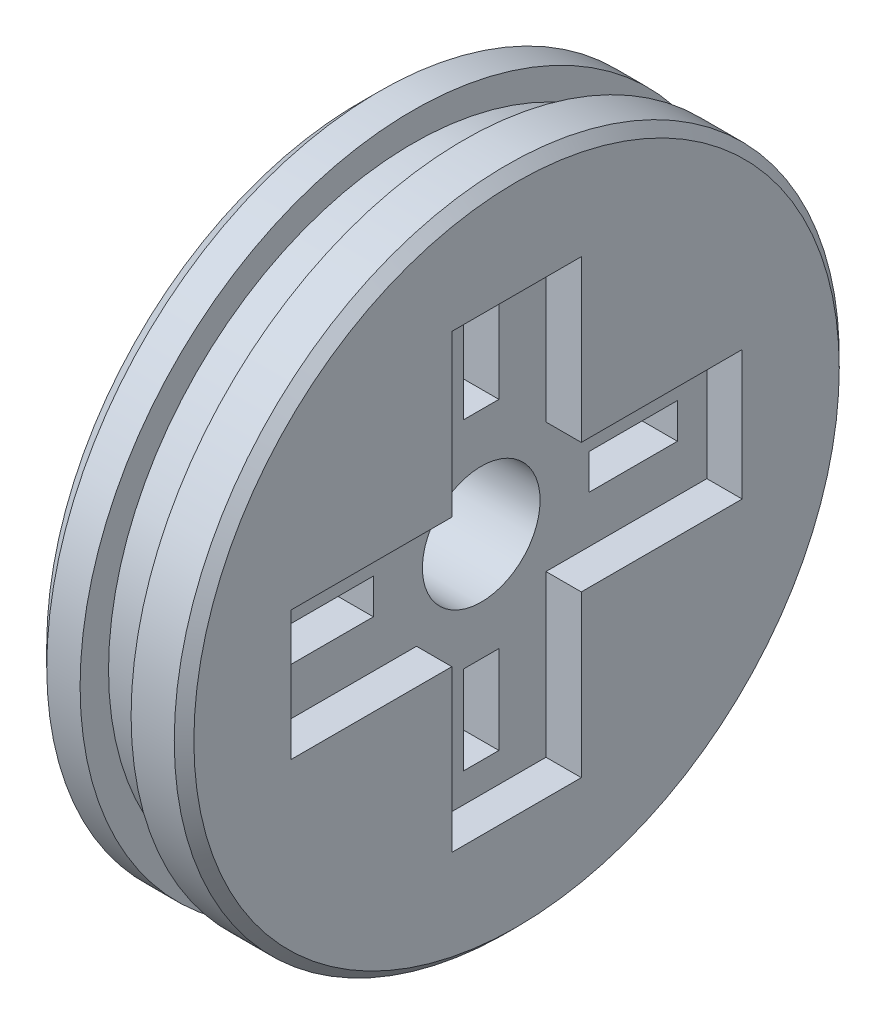
from build123d import *

# Parameters (mm, degrees)
SKETCH2_W            = 2.6
SKETCH2_H            = 2.45
BOSS_EXTRUDE1_START  = 62.7
SKETCH3_W            = 2.3
SKETCH3_H            = 23
BOSS_EXTRUDE1_DEPTH  = 6.6
BOSS_EXTRUDE2_START  = 54.5
SKETCH4_W            = 2.3
SKETCH4_H            = 6.6
BOSS_EXTRUDE2_DEPTH  = 23
BOSS_EXTRUDE3_START  = -79
SKETCH5_R            = 4.6
BOSS_EXTRUDE3_DEPTH  = 2.3
BOSS_EXTRUDE4_START  = -85.7
SKETCH6_R            = 7.1
BOSS_EXTRUDE4_DEPTH  = 1.7
BOSS_EXTRUDE5_START  = -84.1
SKETCH7_R            = 3
BOSS_EXTRUDE5_DEPTH  = 5.2
BOSS_EXTRUDE6_START  = 65.1
SKETCH8_W            = 4.1
SKETCH8_H            = 2.1
BOSS_EXTRUDE6_DEPTH  = 1.8
BOSS_EXTRUDE7_START  = 71.5
SKETCH9_W            = 4.1
SKETCH9_H            = 1.8
BOSS_EXTRUDE7_DEPTH  = 2.1
BOSS_EXTRUDE8_START  = 65.1
SKETCH10_W           = 4.1
SKETCH10_H           = 2.1
BOSS_EXTRUDE8_DEPTH  = 1.8
BOSS_EXTRUDE9_START  = 58.4
SKETCH11_W           = 4.1
SKETCH11_H           = 1.8
BOSS_EXTRUDE9_DEPTH  = 2.1
BOSS_EXTRUDE10_START = 65.1
SKETCH12_W           = 5.3
SKETCH12_H           = 2.4
BOSS_EXTRUDE10_DEPTH = 1.8
BOSS_EXTRUDE11_START = 73.6
SKETCH13_W           = 5.3
SKETCH13_H           = 1.8
BOSS_EXTRUDE11_DEPTH = 2.4
BOSS_EXTRUDE12_START = 65.1
SKETCH14_W           = 5.3
SKETCH14_H           = 2.4
BOSS_EXTRUDE12_DEPTH = 1.8
BOSS_EXTRUDE13_START = 56
SKETCH15_W           = 5.3
SKETCH15_H           = 1.8
BOSS_EXTRUDE13_DEPTH = 2.4


with BuildPart() as part:
    # Sketch1 → Revolve1 (revolve)
    with BuildSketch(Plane.XY.offset(66)):
        Polygon((-77.2, -65), (-85.2, -65), (-85.2, -49.05), (-84.2, -48.05), (-77.7, -48.05), (-77.2, -48.55), align=None)
    revolve(axis=Axis((-90.2, -65, 66), (1, 0, 0)))


with BuildPart() as body_2:
    # Sketch2 → Revolve2 (revolve)
    with BuildSketch(Plane.XY.offset(66)):
        with Locations((-81.2, -48.275)):
            Rectangle(SKETCH2_W, SKETCH2_H)
    revolve(axis=Axis((-87.5, -65, 66), (1, 0, 0)))


with BuildPart() as part_1:
    add(part.part)

    # Combine1: cut body 2
    add(body_2.part, mode=Mode.SUBTRACT)


with BuildPart() as body_2_2:
    # Sketch3 → Boss-Extrude1 (new body)
    with BuildSketch(Plane.XY.offset(BOSS_EXTRUDE1_START)):
        with Locations((-77.85, -65)):
            Rectangle(SKETCH3_W, SKETCH3_H)
    extrude(amount=BOSS_EXTRUDE1_DEPTH)


with BuildPart() as part_2:
    add(part_1.part)

    # Combine2: cut body 2 2
    add(body_2_2.part, mode=Mode.SUBTRACT)


with BuildPart() as body_2_3:
    # Sketch4 → Boss-Extrude2 (new body)
    with BuildSketch(Plane.XY.offset(BOSS_EXTRUDE2_START)):
        with Locations((-77.85, -65)):
            Rectangle(SKETCH4_W, SKETCH4_H)
    extrude(amount=BOSS_EXTRUDE2_DEPTH)


with BuildPart() as part_3:
    add(part_2.part)

    # Combine3: cut body 2 3
    add(body_2_3.part, mode=Mode.SUBTRACT)


with BuildPart() as body_2_4:
    # Sketch5 → Boss-Extrude3 (new body)
    with BuildSketch(Plane(origin=(0, 0, 0), x_dir=(0, 0, -1), z_dir=(1, 0, 0)).offset(BOSS_EXTRUDE3_START)):
        with Locations((-66, -65)):
            Circle(SKETCH5_R)
    extrude(amount=BOSS_EXTRUDE3_DEPTH)


with BuildPart() as part_4:
    add(part_3.part)

    # Combine4: cut body 2 4
    add(body_2_4.part, mode=Mode.SUBTRACT)


with BuildPart() as body_2_5:
    # Sketch6 → Boss-Extrude4 (new body)
    with BuildSketch(Plane(origin=(0, 0, 0), x_dir=(0, 0, -1), z_dir=(1, 0, 0)).offset(BOSS_EXTRUDE4_START)):
        with Locations((-66, -65)):
            Circle(SKETCH6_R)
    extrude(amount=BOSS_EXTRUDE4_DEPTH)


with BuildPart() as part_5:
    add(part_4.part)

    # Combine5: cut body 2 5
    add(body_2_5.part, mode=Mode.SUBTRACT)


with BuildPart() as body_2_6:
    # Sketch7 → Boss-Extrude5 (new body)
    with BuildSketch(Plane(origin=(0, 0, 0), x_dir=(0, 0, -1), z_dir=(1, 0, 0)).offset(BOSS_EXTRUDE5_START)):
        with Locations((-66, -65)):
            Circle(SKETCH7_R)
    extrude(amount=BOSS_EXTRUDE5_DEPTH)


with BuildPart() as part_6:
    add(part_5.part)

    # Combine6: cut body 2 6
    add(body_2_6.part, mode=Mode.SUBTRACT)


with BuildPart() as body_2_7:
    # Sketch8 → Boss-Extrude6 (new body)
    with BuildSketch(Plane.XY.offset(BOSS_EXTRUDE6_START)):
        with Locations((-80.95, -58.45)):
            Rectangle(SKETCH8_W, SKETCH8_H)
    extrude(amount=BOSS_EXTRUDE6_DEPTH)


with BuildPart() as part_7:
    add(part_6.part)

    # Combine7: cut body 2 7
    add(body_2_7.part, mode=Mode.SUBTRACT)


with BuildPart() as body_2_8:
    # Sketch9 → Boss-Extrude7 (new body)
    with BuildSketch(Plane.XY.offset(BOSS_EXTRUDE7_START)):
        with Locations((-80.95, -65)):
            Rectangle(SKETCH9_W, SKETCH9_H)
    extrude(amount=BOSS_EXTRUDE7_DEPTH)


with BuildPart() as part_8:
    add(part_7.part)

    # Combine8: cut body 2 8
    add(body_2_8.part, mode=Mode.SUBTRACT)


with BuildPart() as body_2_9:
    # Sketch10 → Boss-Extrude8 (new body)
    with BuildSketch(Plane.XY.offset(BOSS_EXTRUDE8_START)):
        with Locations((-80.95, -71.55)):
            Rectangle(SKETCH10_W, SKETCH10_H)
    extrude(amount=BOSS_EXTRUDE8_DEPTH)


with BuildPart() as part_9:
    add(part_8.part)

    # Combine9: cut body 2 9
    add(body_2_9.part, mode=Mode.SUBTRACT)


with BuildPart() as body_2_10:
    # Sketch11 → Boss-Extrude9 (new body)
    with BuildSketch(Plane.XY.offset(BOSS_EXTRUDE9_START)):
        with Locations((-80.95, -65)):
            Rectangle(SKETCH11_W, SKETCH11_H)
    extrude(amount=BOSS_EXTRUDE9_DEPTH)


with BuildPart() as part_10:
    add(part_9.part)

    # Combine10: cut body 2 10
    add(body_2_10.part, mode=Mode.SUBTRACT)


with BuildPart() as body_2_11:
    # Sketch12 → Boss-Extrude10 (new body)
    with BuildSketch(Plane.XY.offset(BOSS_EXTRUDE10_START)):
        with Locations((-81.55, -56.2)):
            Rectangle(SKETCH12_W, SKETCH12_H)
    extrude(amount=BOSS_EXTRUDE10_DEPTH)


with BuildPart() as part_11:
    add(part_10.part)

    # Combine11: cut body 2 11
    add(body_2_11.part, mode=Mode.SUBTRACT)


with BuildPart() as body_2_12:
    # Sketch13 → Boss-Extrude11 (new body)
    with BuildSketch(Plane.XY.offset(BOSS_EXTRUDE11_START)):
        with Locations((-81.55, -65)):
            Rectangle(SKETCH13_W, SKETCH13_H)
    extrude(amount=BOSS_EXTRUDE11_DEPTH)


with BuildPart() as part_12:
    add(part_11.part)

    # Combine12: cut body 2 12
    add(body_2_12.part, mode=Mode.SUBTRACT)


with BuildPart() as body_2_13:
    # Sketch14 → Boss-Extrude12 (new body)
    with BuildSketch(Plane.XY.offset(BOSS_EXTRUDE12_START)):
        with Locations((-81.55, -73.8)):
            Rectangle(SKETCH14_W, SKETCH14_H)
    extrude(amount=BOSS_EXTRUDE12_DEPTH)


with BuildPart() as part_13:
    add(part_12.part)

    # Combine13: cut body 2 13
    add(body_2_13.part, mode=Mode.SUBTRACT)


with BuildPart() as body_2_14:
    # Sketch15 → Boss-Extrude13 (new body)
    with BuildSketch(Plane.XY.offset(BOSS_EXTRUDE13_START)):
        with Locations((-81.55, -65)):
            Rectangle(SKETCH15_W, SKETCH15_H)
    extrude(amount=BOSS_EXTRUDE13_DEPTH)


with BuildPart() as part_14:
    add(part_13.part)

    # Combine14: cut body 2 14
    add(body_2_14.part, mode=Mode.SUBTRACT)


solid = part_14.part
